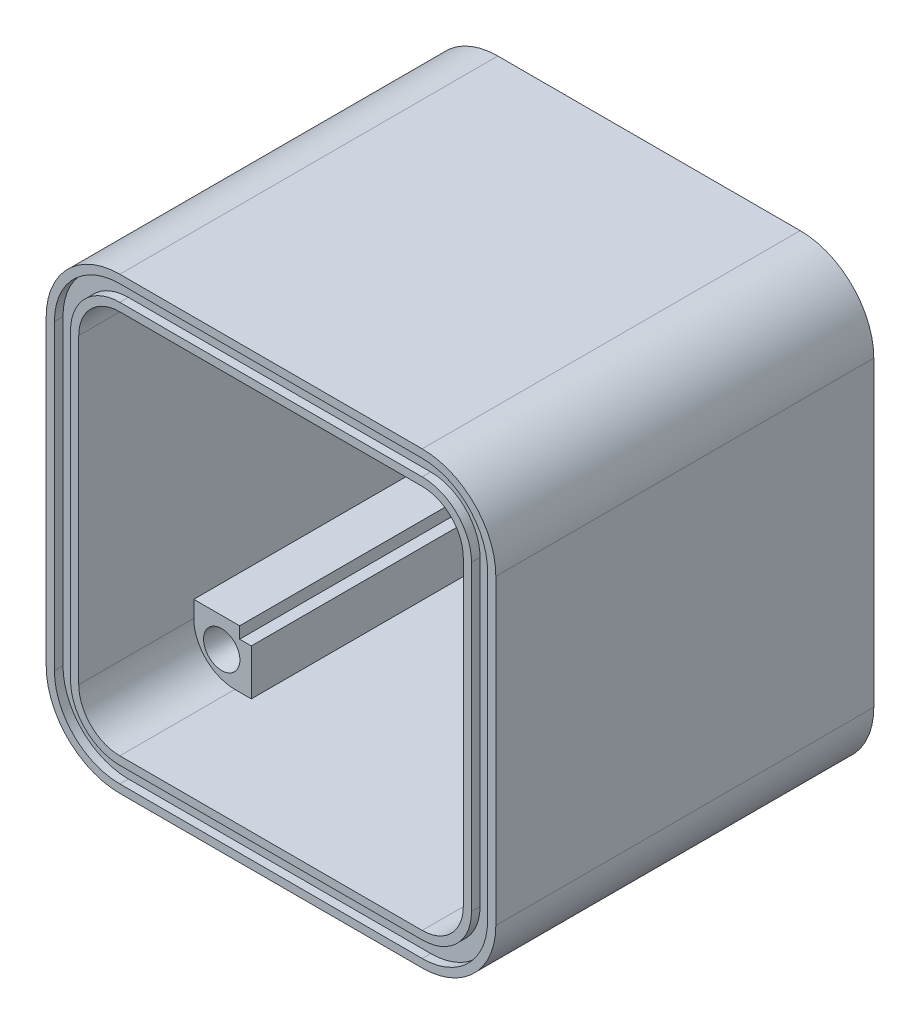
from build123d import *

# Parameters (mm, degrees)
BOSS_EXTRUDE1_DEPTH          = 29.21
SHELL1_T                     = -2.54
FILLET1_R                    = 6.35
BOSS_EXTRUDE2_DEPTH          = 38.1
SKETCH3_R                    = 2.8067
CUT_EXTRUDE1_DEPTH           = 4.7
CUT_EXTRUDE1_DRAFT           = -8
CUT_EXTRUDE1_PROFILE_2_DEPTH = 4.7
CUT_EXTRUDE1_PROFILE_2_DRAFT = -8
CUT_EXTRUDE1_PROFILE_3_DEPTH = 4.7
CUT_EXTRUDE1_PROFILE_3_DRAFT = -8
CUT_EXTRUDE1_PROFILE_4_DEPTH = 4.7
CUT_EXTRUDE1_PROFILE_4_DRAFT = -8
SKETCH5_W                    = 45.253999916
SKETCH5_H                    = 45.253999916
CUT_EXTRUDE5_DEPTH           = 38.1
SKETCH6_OUTSIDE_W            = 88.184
SKETCH6_OUTSIDE_H            = 88.184
CUT_EXTRUDE6_DEPTH           = 1.3208
BOSS_EXTRUDE3_START          = -2.54
BOSS_EXTRUDE3_DEPTH          = 57.0992
BOSS_EXTRUDE7_START          = -57.0992
BOSS_EXTRUDE7_DEPTH          = 58.42


with BuildPart() as part:
    # Sketch1 → Boss-Extrude1 (new, symmetric)
    with BuildSketch(Plane.XY):
        Polygon((-32.258, -32.258), (-32.258, -11.938), (-32.258, 11.938), (-32.258, 32.258), (32.258, 32.258), (32.258, -32.258), align=None)
    extrude(amount=BOSS_EXTRUDE1_DEPTH, both=True)

    # Shell1
    shell1_openings = [part.faces().sort_by_distance(p)[0] for p in [
        (0, 0, 29.21),
    ]]
    offset(amount=SHELL1_T, openings=shell1_openings, kind=Kind.INTERSECTION)

    # Fillet1
    fillet1_edges = [part.edges().sort_by_distance(p)[0] for p in [
        (-32.258, -32.258, 0),
        (-32.258, 32.258, 0),
        (32.258, 32.258, 0),
        (32.258, -32.258, 0),
        (-29.718, -29.718, 1.27),
        (29.718, -29.718, 1.27),
        (29.718, 29.718, 1.27),
        (-29.718, 29.718, 1.27),
    ]]
    fillet(fillet1_edges, radius=FILLET1_R)

    # Sketch2 → Boss-Extrude2 (add)
    with BuildSketch(Plane.XY.offset(-26.67)):
        with BuildLine():
            Line((-20.828, -20.828), (-29.718, -20.828))
            Line((-29.718, -20.828), (-29.718, -23.368))
            ThreePointArc((-29.718, -23.368), (-27.858128061, -27.858128061), (-23.368, -29.718))
            Line((-23.368, -29.718), (-20.828, -29.718))
            Line((-20.828, -29.718), (-20.828, -20.828))
        make_face()
        with BuildLine():
            ThreePointArc((-29.718, 23.368), (-27.858128061, 27.858128061), (-23.368, 29.718))
            Line((-23.368, 29.718), (-20.828, 29.718))
            Line((-20.828, 29.718), (-20.828, 20.828))
            Line((-20.828, 20.828), (-29.718, 20.828))
            Line((-29.718, 20.828), (-29.718, 23.368))
        make_face()
        with BuildLine():
            ThreePointArc((29.718, 23.368), (27.858128061, 27.858128061), (23.368, 29.718))
            Line((23.368, 29.718), (20.828, 29.718))
            Line((20.828, 29.718), (20.828, 20.828))
            Line((20.828, 20.828), (29.718, 20.828))
            Line((29.718, 20.828), (29.718, 23.368))
        make_face()
        with BuildLine():
            ThreePointArc((23.368, -29.718), (27.858128061, -27.858128061), (29.718, -23.368))
            Line((29.718, -23.368), (29.718, -20.828))
            Line((29.718, -20.828), (20.828, -20.828))
            Line((20.828, -20.828), (20.828, -29.718))
            Line((20.828, -29.718), (23.368, -29.718))
        make_face()
    extrude(amount=BOSS_EXTRUDE2_DEPTH)


with BuildPart() as cut_extrude1_tool:
    # Sketch3 → Cut-Extrude1 (with draft: the straight prism first)
    with BuildSketch(Plane.XY.offset(11.43)):
        with Locations((-25.4, -25.4)):
            Circle(SKETCH3_R)
    extrude(amount=-CUT_EXTRUDE1_DEPTH)
    # Cut-Extrude1: the draft: its side faces are tilted about the plane it starts from
    cut_extrude1_sides = [cut_extrude1_tool.faces().sort_by_distance(p)[0] for p in [
        (-28.2067, -25.4, 9.08),
    ]]
    draft(cut_extrude1_sides, Plane.XY.offset(11.43), CUT_EXTRUDE1_DRAFT)


with BuildPart() as part_1:
    add(part.part)

    # Cut-Extrude1: cut by cut_extrude1_tool
    add(cut_extrude1_tool.part, mode=Mode.SUBTRACT)


with BuildPart() as cut_extrude1_profile_2_tool:
    # Sketch3 → Cut-Extrude1 profile 2 (with draft: the straight prism first)
    with BuildSketch(Plane.XY.offset(11.43)):
        with Locations((-25.4, 25.4)):
            Circle(SKETCH3_R)
    extrude(amount=-CUT_EXTRUDE1_PROFILE_2_DEPTH)
    # Cut-Extrude1 profile 2: the draft: its side faces are tilted about the plane it starts from
    cut_extrude1_profile_2_sides = [cut_extrude1_profile_2_tool.faces().sort_by_distance(p)[0] for p in [
        (-28.2067, 25.4, 9.08),
    ]]
    draft(cut_extrude1_profile_2_sides, Plane.XY.offset(11.43), CUT_EXTRUDE1_PROFILE_2_DRAFT)


with BuildPart() as part_2:
    add(part_1.part)

    # Cut-Extrude1 profile 2: cut by cut_extrude1_profile_2_tool
    add(cut_extrude1_profile_2_tool.part, mode=Mode.SUBTRACT)


with BuildPart() as cut_extrude1_profile_3_tool:
    # Sketch3 → Cut-Extrude1 profile 3 (with draft: the straight prism first)
    with BuildSketch(Plane.XY.offset(11.43)):
        with Locations((25.4, 25.4)):
            Circle(SKETCH3_R)
    extrude(amount=-CUT_EXTRUDE1_PROFILE_3_DEPTH)
    # Cut-Extrude1 profile 3: the draft: its side faces are tilted about the plane it starts from
    cut_extrude1_profile_3_sides = [cut_extrude1_profile_3_tool.faces().sort_by_distance(p)[0] for p in [
        (22.5933, 25.4, 9.08),
    ]]
    draft(cut_extrude1_profile_3_sides, Plane.XY.offset(11.43), CUT_EXTRUDE1_PROFILE_3_DRAFT)


with BuildPart() as part_3:
    add(part_2.part)

    # Cut-Extrude1 profile 3: cut by cut_extrude1_profile_3_tool
    add(cut_extrude1_profile_3_tool.part, mode=Mode.SUBTRACT)


with BuildPart() as cut_extrude1_profile_4_tool:
    # Sketch3 → Cut-Extrude1 profile 4 (with draft: the straight prism first)
    with BuildSketch(Plane.XY.offset(11.43)):
        with Locations((25.4, -25.4)):
            Circle(SKETCH3_R)
    extrude(amount=-CUT_EXTRUDE1_PROFILE_4_DEPTH)
    # Cut-Extrude1 profile 4: the draft: its side faces are tilted about the plane it starts from
    cut_extrude1_profile_4_sides = [cut_extrude1_profile_4_tool.faces().sort_by_distance(p)[0] for p in [
        (22.5933, -25.4, 9.08),
    ]]
    draft(cut_extrude1_profile_4_sides, Plane.XY.offset(11.43), CUT_EXTRUDE1_PROFILE_4_DRAFT)


with BuildPart() as part_4:
    add(part_3.part)

    # Cut-Extrude1 profile 4: cut by cut_extrude1_profile_4_tool
    add(cut_extrude1_profile_4_tool.part, mode=Mode.SUBTRACT)

    # Sketch5 → Cut-Extrude5 (cut)
    with BuildSketch(Plane.XY.offset(11.43)):
        Rectangle(SKETCH5_W, SKETCH5_H)
    extrude(amount=-CUT_EXTRUDE5_DEPTH, mode=Mode.SUBTRACT)

    # Sketch6 outside → Cut-Extrude6 (cut)
    # profile 1 of 2: a face of its own
    with BuildSketch(Plane.XY.offset(29.21)):
        Rectangle(SKETCH6_OUTSIDE_W, SKETCH6_OUTSIDE_H)
        with BuildLine():
            Line((23.368, 30.988), (20.828, 30.988))
            Line((20.828, 30.988), (-20.828, 30.988))
            Line((-20.828, 30.988), (-23.368, 30.988))
            ThreePointArc((-23.368, 30.988), (-28.756153673, 28.756153673), (-30.988, 23.368))
            Line((-30.988, 23.368), (-30.988, -23.368))
            ThreePointArc((-30.988, -23.368), (-28.756153673, -28.756153673), (-23.368, -30.988))
            Line((-23.368, -30.988), (-20.828, -30.988))
            Line((-20.828, -30.988), (20.828, -30.988))
            Line((20.828, -30.988), (23.368, -30.988))
            ThreePointArc((23.368, -30.988), (28.756153673, -28.756153673), (30.988, -23.368))
            Line((30.988, -23.368), (30.988, 23.368))
            ThreePointArc((30.988, 23.368), (28.756153673, 28.756153673), (23.368, 30.988))
        make_face(mode=Mode.SUBTRACT)
    # profile 2 of 2: a face of its own
    with BuildSketch(Plane.XY.offset(29.21)):
        with BuildLine():
            Line((23.368, 29.718), (20.828, 29.718))
            Line((20.828, 29.718), (-20.828, 29.718))
            Line((-20.828, 29.718), (-23.368, 29.718))
            ThreePointArc((-23.368, 29.718), (-27.858128061, 27.858128061), (-29.718, 23.368))
            Line((-29.718, 23.368), (-29.718, -23.368))
            ThreePointArc((-29.718, -23.368), (-27.858128061, -27.858128061), (-23.368, -29.718))
            Line((-23.368, -29.718), (-20.828, -29.718))
            Line((-20.828, -29.718), (20.828, -29.718))
            Line((20.828, -29.718), (23.368, -29.718))
            ThreePointArc((23.368, -29.718), (27.858128061, -27.858128061), (29.718, -23.368))
            Line((29.718, -23.368), (29.718, 23.368))
            ThreePointArc((29.718, 23.368), (27.858128061, 27.858128061), (23.368, 29.718))
        make_face()
    extrude(amount=-CUT_EXTRUDE6_DEPTH, mode=Mode.SUBTRACT)

    # Sketch7 → Boss-Extrude3 (add)
    with BuildSketch(Plane.XY.offset(-26.67).offset(BOSS_EXTRUDE3_START)):
        with BuildLine():
            Line((33.4772, -23.368), (33.4772, 23.368))
            ThreePointArc((33.4772, 23.368), (30.516283872, 30.516283872), (23.368, 33.4772))
            Line((23.368, 33.4772), (-23.368, 33.4772))
            ThreePointArc((-23.368, 33.4772), (-30.516283872, 30.516283872), (-33.4772, 23.368))
            Line((-33.4772, 23.368), (-33.4772, -23.368))
            ThreePointArc((-33.4772, -23.368), (-30.516283872, -30.516283872), (-23.368, -33.4772))
            Line((-23.368, -33.4772), (23.368, -33.4772))
            ThreePointArc((23.368, -33.4772), (30.516283872, -30.516283872), (33.4772, -23.368))
        make_face()
        with BuildLine():
            Line((23.368, 32.2072), (-23.368, 32.2072))
            ThreePointArc((-23.368, 32.2072), (-29.61825826, 29.61825826), (-32.2072, 23.368))
            Line((-32.2072, 23.368), (-32.2072, -23.368))
            ThreePointArc((-32.2072, -23.368), (-29.61825826, -29.61825826), (-23.368, -32.2072))
            Line((-23.368, -32.2072), (23.368, -32.2072))
            ThreePointArc((23.368, -32.2072), (29.61825826, -29.61825826), (32.2072, -23.368))
            Line((32.2072, -23.368), (32.2072, 23.368))
            ThreePointArc((32.2072, 23.368), (29.61825826, 29.61825826), (23.368, 32.2072))
        make_face(mode=Mode.SUBTRACT)
    extrude(amount=BOSS_EXTRUDE3_DEPTH)

    # Sketch9 → Boss-Extrude7 (add)
    with BuildSketch(Plane.XY.offset(27.8892).offset(BOSS_EXTRUDE7_START)):
        with BuildLine():
            Line((34.7472, -23.368), (34.7472, 23.368))
            ThreePointArc((34.7472, 23.368), (31.414309484, 31.414309484), (23.368, 34.7472))
            Line((23.368, 34.7472), (-23.368, 34.7472))
            ThreePointArc((-23.368, 34.7472), (-31.414309484, 31.414309484), (-34.7472, 23.368))
            Line((-34.7472, 23.368), (-34.7472, -23.368))
            ThreePointArc((-34.7472, -23.368), (-31.414309484, -31.414309484), (-23.368, -34.7472))
            Line((-23.368, -34.7472), (23.368, -34.7472))
            ThreePointArc((23.368, -34.7472), (31.414309484, -31.414309484), (34.7472, -23.368))
        make_face()
        with BuildLine():
            Line((23.368, 33.4772), (-23.368, 33.4772))
            ThreePointArc((-23.368, 33.4772), (-30.516283872, 30.516283872), (-33.4772, 23.368))
            Line((-33.4772, 23.368), (-33.4772, -23.368))
            ThreePointArc((-33.4772, -23.368), (-30.516283872, -30.516283872), (-23.368, -33.4772))
            Line((-23.368, -33.4772), (23.368, -33.4772))
            ThreePointArc((23.368, -33.4772), (30.516283872, -30.516283872), (33.4772, -23.368))
            Line((33.4772, -23.368), (33.4772, 23.368))
            ThreePointArc((33.4772, 23.368), (30.516283872, 30.516283872), (23.368, 33.4772))
        make_face(mode=Mode.SUBTRACT)
    extrude(amount=BOSS_EXTRUDE7_DEPTH)


solid = part_4.part
